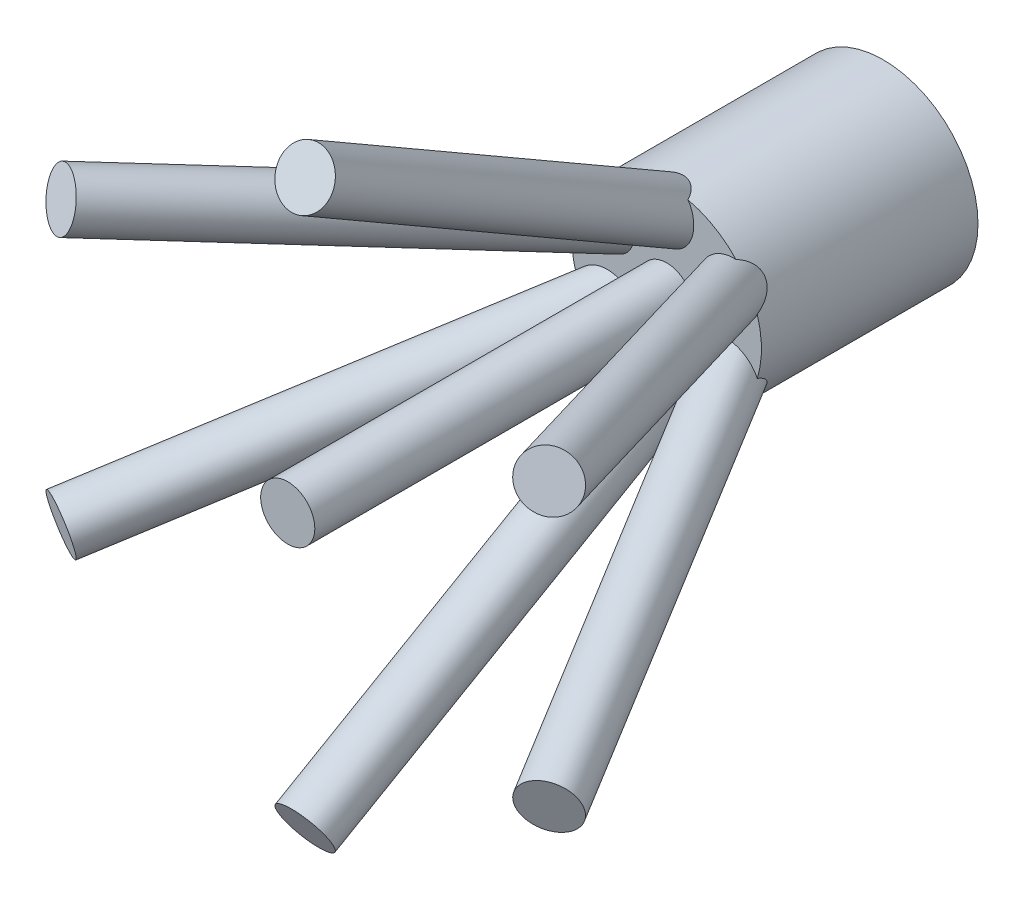
from build123d import *

# Parameters (mm, degrees)
SKETCH1_R         = 0.4445
EXTRUDE1_DEPTH    = 1.016
SKETCH2_R         = 0.127
EXTRUDE2_DEPTH    = 1.778
CIRPATTERN1_COUNT = 6


with BuildPart() as part:
    # Sketch1 → Extrude1 (new body)
    with BuildSketch(Plane.XY):
        Circle(SKETCH1_R)
    extrude(amount=EXTRUDE1_DEPTH)

    # Sketch2 → Extrude2 (add)
    with BuildSketch(Plane.XY.offset(1.016)):
        Circle(SKETCH2_R)
    extrude(amount=EXTRUDE2_DEPTH)

    # Sketch5 → Revolve1 (revolve)
    with BuildSketch(Plane(origin=(0, 0, 0), x_dir=(0, 0, -1), z_dir=(1, 0, 0))):
        Polygon((-0.889254909, 0.415928891), (-0.952754909, 0.305943665), (-2.712518529, 1.321943665), (-2.649018529, 1.431928891), align=None)
    revolve1 = revolve(axis=Axis((0, 1.321943665, 2.712518529), (0, -0.49999999999998906, -0.866025403784445)))

    # CirPattern1: Revolve1 ×6 about axis
    cirpattern1_axis = Axis((0, 0, 2.794), (0, 0, -1))
    for i in range(1, CIRPATTERN1_COUNT):
        add(revolve1.rotate(cirpattern1_axis, i * 360 / CIRPATTERN1_COUNT))


solid = part.part
